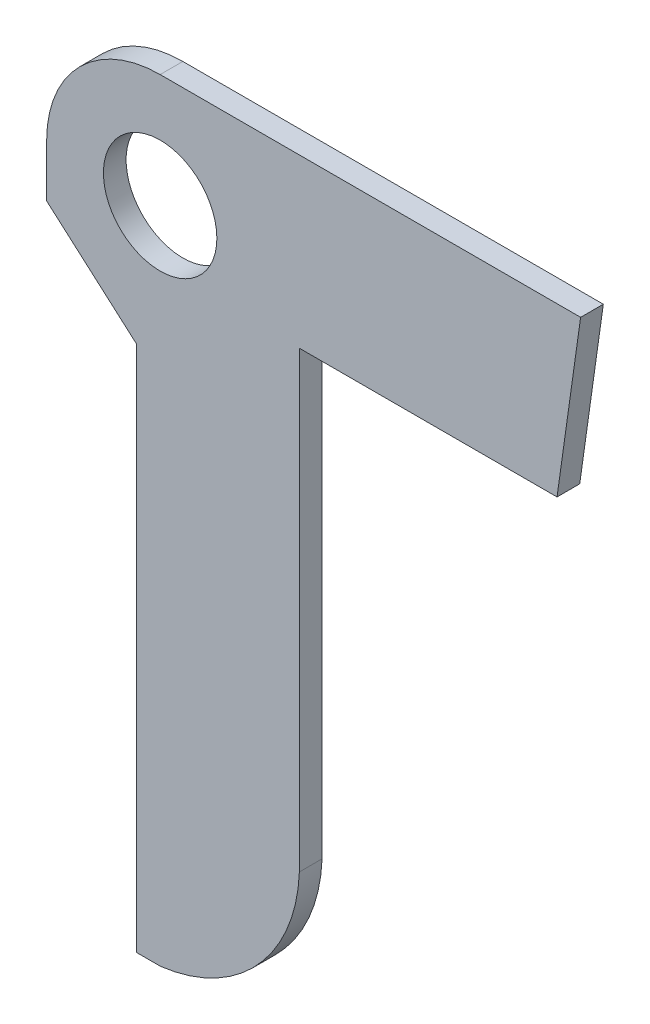
from build123d import *

# Parameters (mm, degrees)
SKETCH_1_R      = 2.5
EXTRUDE_1_DEPTH = 1


with BuildPart() as part:
    # 스케치1 → 보스-돌출1 (new body)
    with BuildSketch(Plane.XY):
        with BuildLine():
            Line((18.529028891, 5), (0, 5))
            ThreePointArc((0, 5), (-3.535533906, 3.535533906), (-5, 0))
            Line((-5, 0), (-5, -2.326474397))
            Line((-5, -2.326474397), (-1.043619368, -5.799632967))
            Line((-1.043619368, -5.799632967), (-1.043619368, -29.024920851))
            Line((-1.043619368, -29.024920851), (0.023324735, -29.024920851))
            ThreePointArc((0.023324735, -29.024920851), (4.304027875, -26.817883884), (6.134722324, -22.363224595))
            Line((6.134722324, -22.363224595), (6.134722324, -2.376138068))
            Line((6.134722324, -2.376138068), (17.489524427, -2.376138068))
            Line((17.489524427, -2.376138068), (18.529028891, 5))
        make_face()
        Circle(SKETCH_1_R, mode=Mode.SUBTRACT)
    extrude(amount=EXTRUDE_1_DEPTH)


solid = part.part
